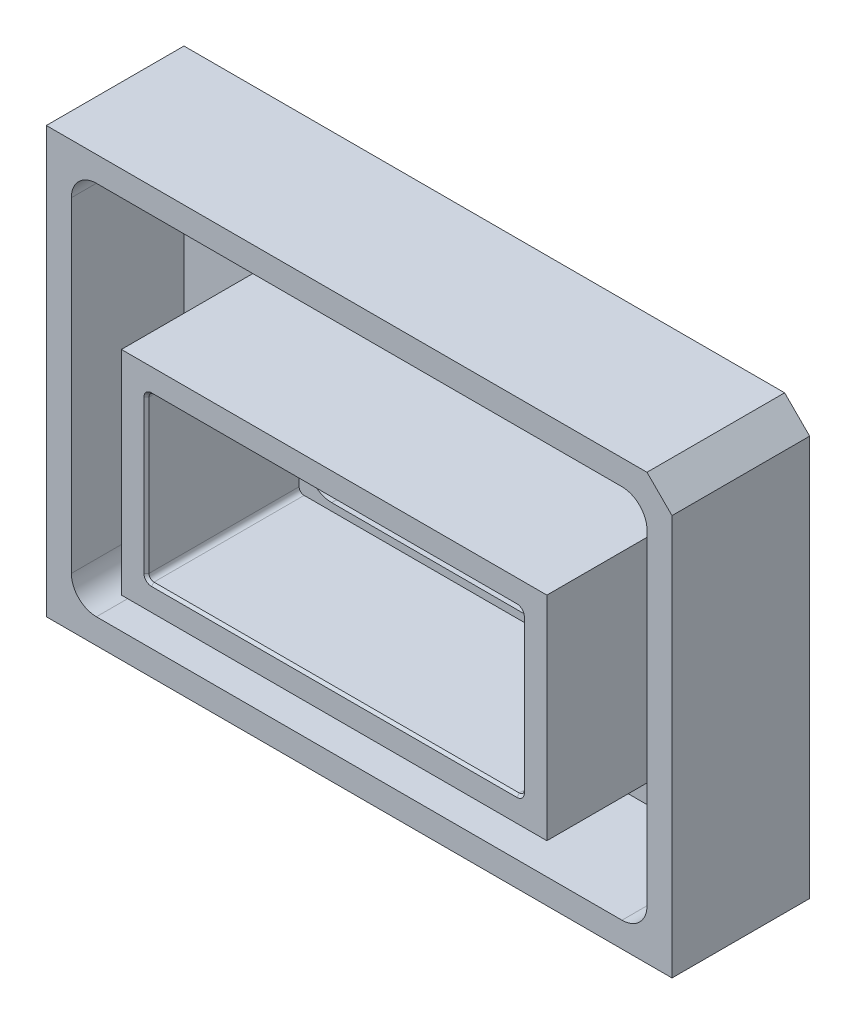
from build123d import *

# Parameters (mm, degrees)
SKETCH1_W                   = 250
SKETCH1_H                   = 170
BOSS_EXTRUDE3_DEPTH         = 65
CUT_EXTRUDE1_START          = 4
SKETCH1_3_W                 = 150
SKETCH1_3_H                 = 65
CUT_EXTRUDE1_DEPTH          = 166.92645468
SKETCH6_W                   = 230
SKETCH6_H                   = 150
SKETCH6_W_2                 = 170
SKETCH6_H_2                 = 85
CUT_EXTRUDE2_DEPTH          = 55
SKETCH7_W                   = 144
SKETCH7_H                   = 59
CUT_EXTRUDE3_DEPTH          = 169.436931817
TAP_DRILL_FOR_M3_TAP1_D     = 2.5
TAP_DRILL_FOR_M3_TAP1_DEPTH = 5
TAP_DRILL_FOR_M3_TAP1_TIP   = 0.751075774
TAP_DRILL_FOR_M3_TAP3_D     = 2.5
TAP_DRILL_FOR_M3_TAP3_DEPTH = 5
TAP_DRILL_FOR_M3_TAP3_TIP   = 0.751075774
FILLET3_R                   = 10
CUT_EXTRUDE4_START          = -10
SKETCH19_W                  = 250
SKETCH19_H                  = 170
CUT_EXTRUDE4_DEPTH          = 10
FILLET2_R                   = 2
CHAMFER1_SIZE               = 1
CHAMFER2_SIZE               = 10


with BuildPart() as part:
    # Sketch1 → Boss-Extrude3 (new body)
    with BuildSketch(Plane.XY):
        with Locations((0, 10)):
            Rectangle(SKETCH1_W, SKETCH1_H)
    extrude(amount=BOSS_EXTRUDE3_DEPTH)

    # Sketch1<3> → Cut-Extrude1 (cut, through all)
    with BuildSketch(Plane.XY.offset(CUT_EXTRUDE1_START)):
        Rectangle(SKETCH1_3_W, SKETCH1_3_H)
    extrude(amount=CUT_EXTRUDE1_DEPTH, mode=Mode.SUBTRACT)

    # Sketch6 → Cut-Extrude2 (cut)
    with BuildSketch(Plane.XY.offset(65)):
        with Locations((0, 10)):
            Rectangle(SKETCH6_W, SKETCH6_H)
        Rectangle(SKETCH6_W_2, SKETCH6_H_2, mode=Mode.SUBTRACT)
    extrude(amount=-CUT_EXTRUDE2_DEPTH, mode=Mode.SUBTRACT)

    # Sketch7 → Cut-Extrude3 (cut, through all)
    with BuildSketch(Plane.XY.offset(4)):
        Rectangle(SKETCH7_W, SKETCH7_H)
    extrude(amount=-CUT_EXTRUDE3_DEPTH, mode=Mode.SUBTRACT)

    # Tap Drill for M3 Tap1
    with Locations(Plane(origin=(0, -75, 0), x_dir=(-1, 0, 0), z_dir=(0, -1, 0))):
        with Locations((-60, -5), (0, -5), (60, -5)):
            Hole(TAP_DRILL_FOR_M3_TAP1_D / 2, depth=TAP_DRILL_FOR_M3_TAP1_DEPTH)
            with Locations((0, 0, -(TAP_DRILL_FOR_M3_TAP1_DEPTH + TAP_DRILL_FOR_M3_TAP1_TIP / 2))):  # 118° drill point
                Cone(0, TAP_DRILL_FOR_M3_TAP1_D / 2, TAP_DRILL_FOR_M3_TAP1_TIP, mode=Mode.SUBTRACT)

    # Tap Drill for M3 Tap3
    with Locations(Plane.ZY.offset(125)):
        with Locations((5, 60), (5, 0), (5, -60)):
            Hole(TAP_DRILL_FOR_M3_TAP3_D / 2, depth=TAP_DRILL_FOR_M3_TAP3_DEPTH)
            with Locations((0, 0, -(TAP_DRILL_FOR_M3_TAP3_DEPTH + TAP_DRILL_FOR_M3_TAP3_TIP / 2))):  # 118° drill point
                Cone(0, TAP_DRILL_FOR_M3_TAP3_D / 2, TAP_DRILL_FOR_M3_TAP3_TIP, mode=Mode.SUBTRACT)

    # Fillet3
    fillet3_edges = [part.edges().sort_by_distance(p)[0] for p in [
        (115, -65, 37.5),
        (115, 85, 37.5),
        (-115, 85, 37.5),
        (-115, -65, 37.5),
        (-72, -29.5, 2),
        (-72, 29.5, 2),
        (72, 29.5, 2),
        (72, -29.5, 2),
    ]]
    fillet(fillet3_edges, radius=FILLET3_R)

    # Sketch19 → Cut-Extrude4 (cut)
    with BuildSketch(Plane.XY.offset(65).offset(CUT_EXTRUDE4_START)):
        with Locations((0, 10)):
            Rectangle(SKETCH19_W, SKETCH19_H)
        with BuildLine():
            Line((-115, 75), (-115, -55))
            ThreePointArc((-115, -55), (-112.071067812, -62.071067812), (-105, -65))
            Line((-105, -65), (105, -65))
            ThreePointArc((105, -65), (112.071067812, -62.071067812), (115, -55))
            Line((115, -55), (115, 75))
            ThreePointArc((115, 75), (112.071067812, 82.071067812), (105, 85))
            Line((105, 85), (-105, 85))
            ThreePointArc((-105, 85), (-112.071067812, 82.071067812), (-115, 75))
        make_face(mode=Mode.SUBTRACT)
    extrude(amount=CUT_EXTRUDE4_DEPTH, mode=Mode.SUBTRACT)

    # Fillet2
    fillet2_edges = [part.edges().sort_by_distance(p)[0] for p in [
        (-75, 32.5, 34.5),
        (-75, -32.5, 34.5),
        (75, -32.5, 34.5),
        (75, 32.5, 34.5),
    ]]
    fillet(fillet2_edges, radius=FILLET2_R)

    # Chamfer1
    chamfer1_edges = [part.edges().sort_by_distance(p)[0] for p in [
        (-75, 0, 65),
        (0, -32.5, 65),
        (75, 0, 65),
        (0, 32.5, 65),
        (-74.414213562, -31.914213562, 65),
        (74.414213562, -31.914213562, 65),
        (74.414213562, 31.914213562, 65),
        (-74.414213562, 31.914213562, 65),
    ]]
    chamfer(chamfer1_edges, length=CHAMFER1_SIZE)

    # Chamfer2
    chamfer2_edges = [part.edges().sort_by_distance(p)[0] for p in [
        (125, 95, 27.5),
    ]]
    chamfer(chamfer2_edges, length=CHAMFER2_SIZE)


solid = part.part
